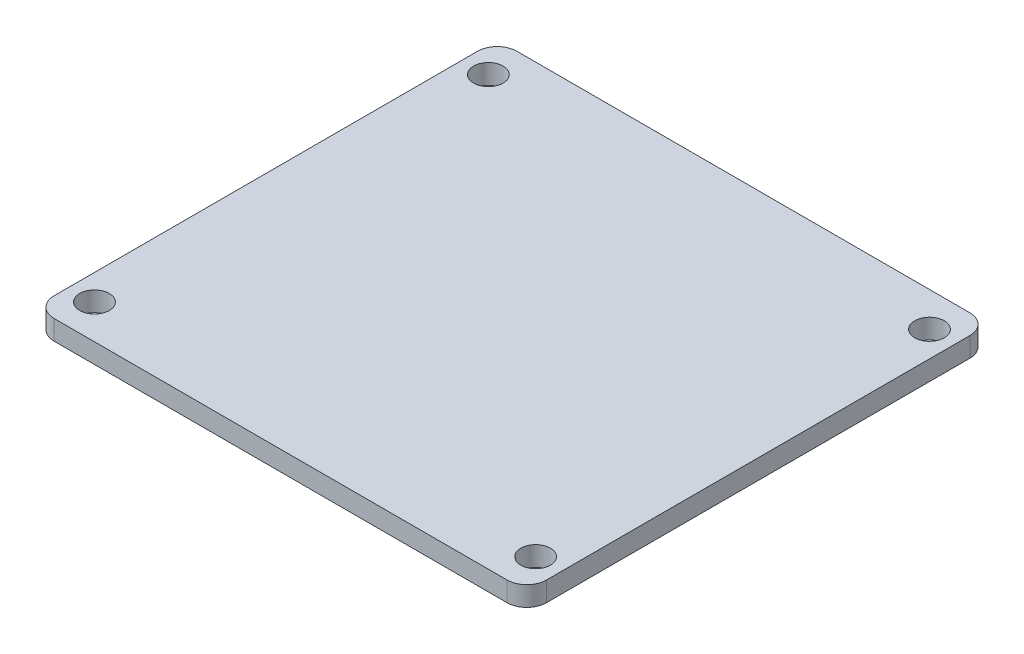
from build123d import *

# Parameters (mm, degrees)
SKETCH_1_W      = 50
SKETCH_1_H      = 47
SKETCH_1_R      = 1.5
EXTRUDE_1_DEPTH = 2
FILLET_1_R      = 2


with BuildPart() as part:
    # 草图1 → 凸台-拉伸1 (new body)
    with BuildSketch(Plane(origin=(0, 0, 0), x_dir=(1, 0, 0), z_dir=(0, 1, 0))):
        Rectangle(SKETCH_1_W, SKETCH_1_H)
        with Locations(Location((-22.4, 20, 0), (0, 0, 270))):
            Circle(SKETCH_1_R, mode=Mode.SUBTRACT)
        with Locations(Location((22.4, 20, 0), (0, 0, 90))):
            Circle(SKETCH_1_R, mode=Mode.SUBTRACT)
        with Locations(Location((22.4, -20, 0), (0, 0, 270))):
            Circle(SKETCH_1_R, mode=Mode.SUBTRACT)
        with Locations(Location((-22.4, -20, 0), (0, 0, 90))):
            Circle(SKETCH_1_R, mode=Mode.SUBTRACT)
    extrude(amount=EXTRUDE_1_DEPTH)

    # 圆角1
    fillet_1_edges = [part.edges().sort_by_distance(p)[0] for p in [
        (25, 1, 23.5),
        (-25, 1, 23.5),
        (-25, 1, -23.5),
        (25, 1, -23.5),
    ]]
    fillet(fillet_1_edges, radius=FILLET_1_R)


solid = part.part
